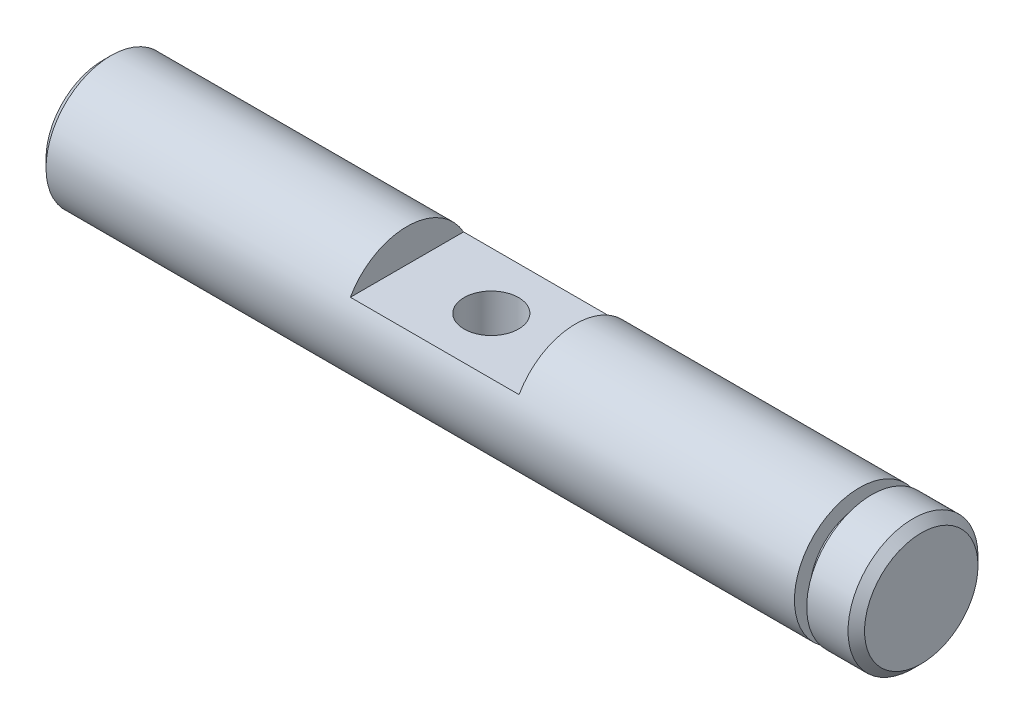
from build123d import *

# Parameters (mm, degrees)
CHAFL_N1_SIZE             = 0.5
CORTAR_EXTRUIR1_DEPTH     = 10.2
TALADRO_ROSCADO_M4X0_71_D = 3.3


with BuildPart() as part:
    # Croquis1 → Revolución1 (revolve)
    with BuildSketch(Plane(origin=(0, 0, 0), x_dir=(0, 1, 0), z_dir=(0, 0, 1)), mode=Mode.PRIVATE) as revoluci_n1_sk:
        Polygon((0, 0), (3.93, 0), (3.93, 3), (3, 3), (3, 3.74), (3.93, 3.74), (3.93, 49.5), (0, 49.5), align=None)
    revolve(revoluci_n1_sk.sketch.rotate(Axis((0, 0, 0), (-1, 0, 0)), 90), axis=Axis((0, 0, 0), (-1, 0, 0)))

    # Chaflán1
    chafl_n1_edges = [part.edges().sort_by_distance(p)[0] for p in [
        (-49.5, 0, 3.93),
        (0, 0, 3.93),
    ]]
    chamfer(chafl_n1_edges, length=CHAFL_N1_SIZE)

    # Croquis2 → Cortar-Extruir1 (cut)
    with BuildSketch(Plane.ZY.offset(31.1)):
        with BuildLine():
            Line((-3.423448554, 1.93), (3.423448554, 1.93))
            ThreePointArc((3.423448554, 1.93), (0, 3.93), (-3.423448554, 1.93))
        make_face()
    extrude(amount=-CORTAR_EXTRUIR1_DEPTH, mode=Mode.SUBTRACT)

    # Taladro roscado M4x0.71 (through all)
    with Locations(Plane(origin=(0, 1.93, 0), x_dir=(-1, 0, 0), z_dir=(0, 1, 0))):
        with Locations((26, 0)):
            Hole(TALADRO_ROSCADO_M4X0_71_D / 2)


solid = part.part
